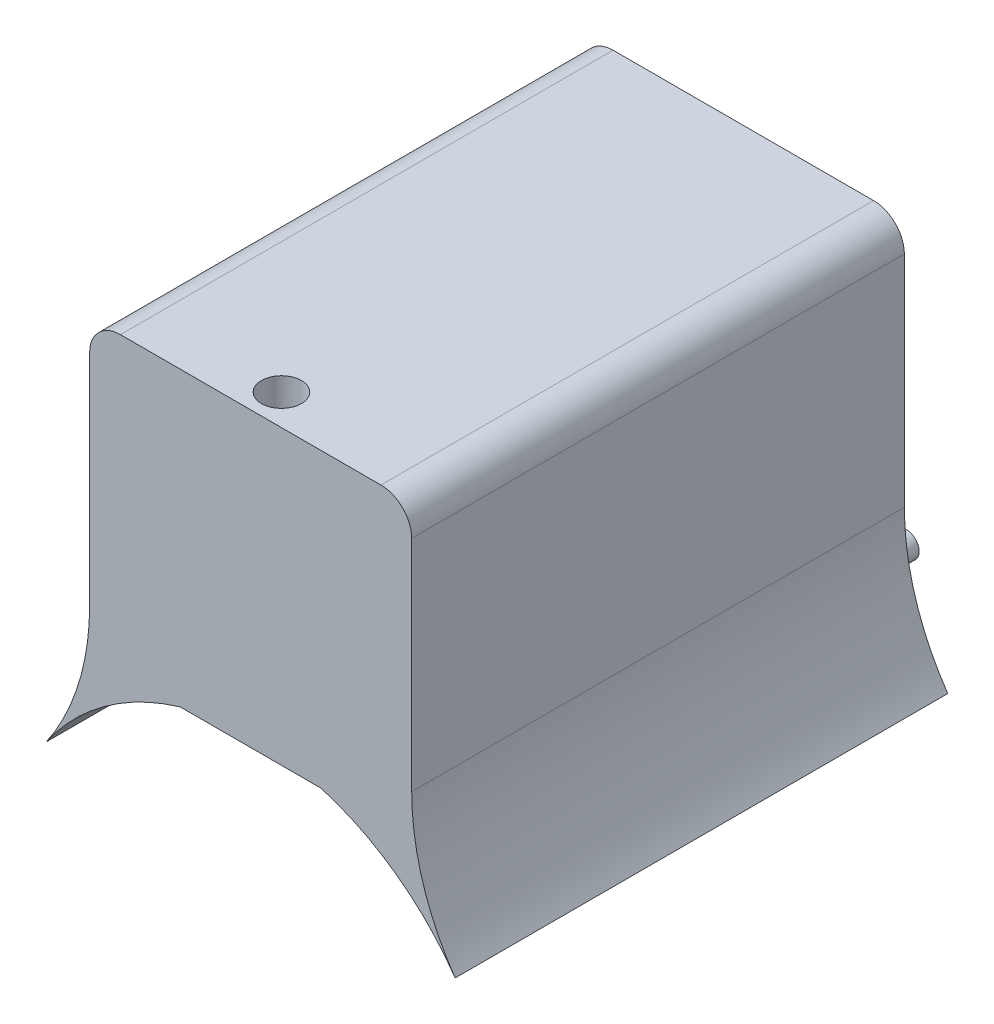
from build123d import *

# Parameters (mm, degrees)
BOSS_EXTRUDE1_DEPTH = 80
FILLET1_R           = 1
SKETCH4_R           = 2.05
BOSS_EXTRUDE2_DEPTH = 3.5
BOSS_EXTRUDE3_START = -15
BOSS_EXTRUDE3_DEPTH = 15
SKETCH6_R           = 3.25
CUT_EXTRUDE1_DEPTH  = 44.5
SKETCH8_R           = 1.65
CUT_EXTRUDE2_DEPTH  = 179.465826414


with BuildPart() as part:
    # Sketch1 → Boss-Extrude1 (new body)
    with BuildSketch(Plane.XY):
        with BuildLine():
            Line((-141.65, 83.343364131), (-141.65, 117.256635869))
            Line((-141.65, 117.256635869), (-141.65, 119.95))
            ThreePointArc((-141.65, 119.95), (-141.064213562, 121.364213562), (-139.65, 121.95))
            Line((-139.65, 121.95), (-136.956635869, 121.95))
            Line((-136.956635869, 121.95), (-103.043364131, 121.95))
            Line((-103.043364131, 121.95), (-100.35, 121.95))
            ThreePointArc((-100.35, 121.95), (-98.935786438, 121.364213562), (-98.35, 119.95))
            Line((-98.35, 119.95), (-98.35, 117.256635869))
            Line((-98.35, 117.256635869), (-98.35, 83.343364131))
            Line((-98.35, 83.343364131), (-98.35, 80.65))
            ThreePointArc((-98.35, 80.65), (-98.935786438, 79.235786438), (-100.35, 78.65))
            Line((-100.35, 78.65), (-103.043364131, 78.65))
            Line((-103.043364131, 78.65), (-107.615836726, 78.65))
            ThreePointArc((-107.615836726, 78.65), (-95.926385052, 72.619515209), (-86.80143213, 63.146117643))
            ThreePointArc((-86.80143213, 63.146117643), (-92.047233442, 73.949028976), (-93.85, 85.822164931))
            Line((-93.85, 85.822164931), (-93.85, 121.45))
            ThreePointArc((-93.85, 121.45), (-95.314466094, 124.985533906), (-98.85, 126.45))
            Line((-98.85, 126.45), (-141.15, 126.45))
            ThreePointArc((-141.15, 126.45), (-144.685533906, 124.985533906), (-146.15, 121.45))
            Line((-146.15, 121.45), (-146.15, 85.822164931))
            ThreePointArc((-146.15, 85.822164931), (-147.952766558, 73.949028976), (-153.19856787, 63.146117643))
            ThreePointArc((-153.19856787, 63.146117643), (-144.073614948, 72.619515209), (-132.384163274, 78.65))
            Line((-132.384163274, 78.65), (-136.956635869, 78.65))
            Line((-136.956635869, 78.65), (-139.65, 78.65))
            ThreePointArc((-139.65, 78.65), (-141.064213562, 79.235786438), (-141.65, 80.65))
            Line((-141.65, 80.65), (-141.65, 83.343364131))
        make_face()
    extrude(amount=BOSS_EXTRUDE1_DEPTH)

    # Fillet1
    fillet1_edges = [part.edges().sort_by_distance(p)[0] for p in [
        (-107.615836726, 78.65, 40),
        (-132.384163274, 78.65, 40),
    ]]
    fillet(fillet1_edges, radius=FILLET1_R)

    # Sketch4 → Boss-Extrude2 (add)
    with BuildSketch(Plane(origin=(0, 0, 0), x_dir=(-1, 0, 0), z_dir=(0, 0, -1))):
        with Locations(Location((143, 77.3, 0), (0, 0, 180))):
            Circle(SKETCH4_R)
        with Locations(Location((97, 77.3, 0), (0, 0, 180))):
            Circle(SKETCH4_R)
    extrude(amount=BOSS_EXTRUDE2_DEPTH)

    # Sketch5 → Boss-Extrude3 (add)
    with BuildSketch(Plane.XY.offset(80).offset(BOSS_EXTRUDE3_START)):
        with BuildLine():
            Line((-93.85, 85.822164931), (-93.85, 121.45))
            ThreePointArc((-93.85, 121.45), (-95.314466094, 124.985533906), (-98.85, 126.45))
            Line((-98.85, 126.45), (-141.15, 126.45))
            ThreePointArc((-141.15, 126.45), (-144.685533906, 124.985533906), (-146.15, 121.45))
            Line((-146.15, 121.45), (-146.15, 85.822164931))
            ThreePointArc((-146.15, 85.822164931), (-147.952766558, 73.949028976), (-153.19856787, 63.146117643))
            ThreePointArc((-153.19856787, 63.146117643), (-143.664305463, 72.920402311), (-131.413478874, 78.95))
            Line((-131.413478874, 78.95), (-108.586521126, 78.95))
            ThreePointArc((-108.586521126, 78.95), (-96.335694537, 72.920402311), (-86.80143213, 63.146117643))
            ThreePointArc((-86.80143213, 63.146117643), (-92.047233442, 73.949028976), (-93.85, 85.822164931))
        make_face()
    extrude(amount=BOSS_EXTRUDE3_DEPTH)

    # Sketch6 → Cut-Extrude1 (cut)
    with BuildSketch(Plane(origin=(0, 126.45, 0), x_dir=(1, 0, 0), z_dir=(0, 1, 0))):
        with Locations(Location((-120, -75, 0), (0, 0, 270))):
            Circle(SKETCH6_R)
    extrude(amount=-CUT_EXTRUDE1_DEPTH, mode=Mode.SUBTRACT)

    # Sketch8 → Cut-Extrude2 (cut, through all)
    with BuildSketch(Plane(origin=(0, 81.95, 0), x_dir=(1, 0, 0), z_dir=(0, 1, 0))):
        with Locations(Location((-120, -75, 0), (0, 0, 270))):
            Circle(SKETCH8_R)
    extrude(amount=-CUT_EXTRUDE2_DEPTH, mode=Mode.SUBTRACT)


solid = part.part
